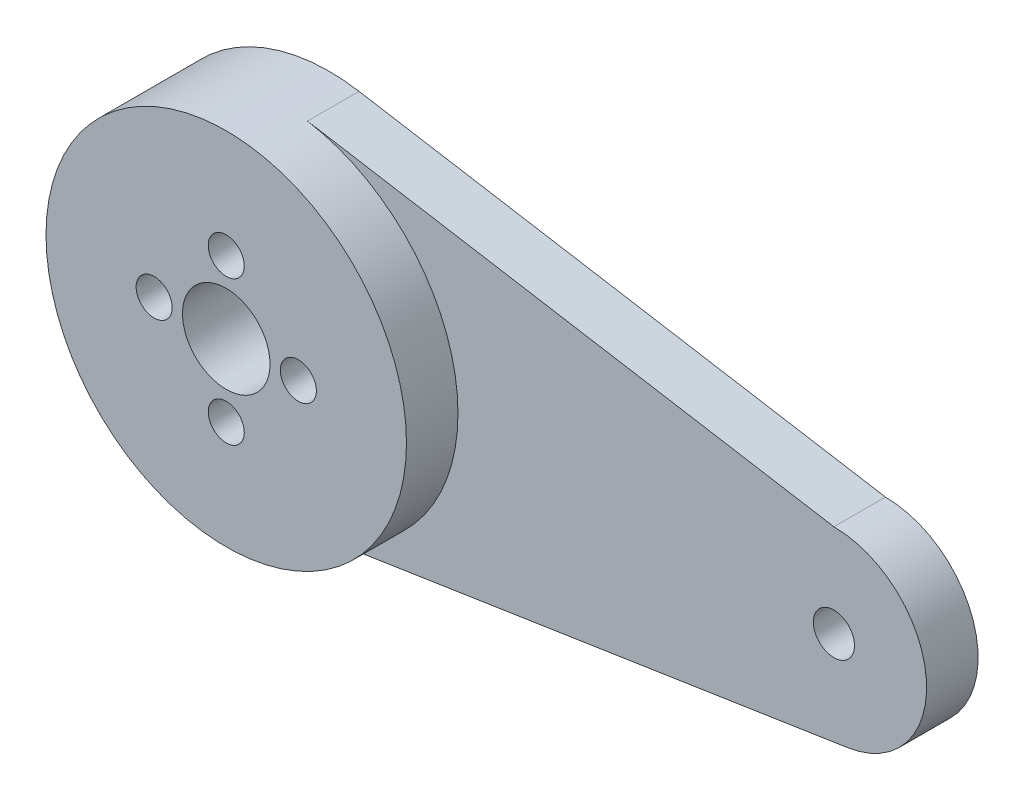
from build123d import *

# Parameters (mm, degrees)
SKETCH2_R           = 4.25
SKETCH2_R_2         = 2
BOSS_EXTRUDE1_DEPTH = 5
SKETCH_1_R          = 1.75
CUT_EXTRUDE_1_DEPTH = 10
EXTRUDE_START       = 5
SKETCH_2_R          = 17.5
SKETCH_2_R_2        = 1.75
SKETCH_2_R_3        = 4.25
EXTRUDE_1_DEPTH     = 5


with BuildPart() as part:
    # Sketch2 → Boss-Extrude1 (new body)
    with BuildSketch(Plane.XY):
        with BuildLine():
            Line((-17.328874887, 74.839530577), (33.78000003, 66.278338859))
            ThreePointArc((33.78000003, 66.278338859), (42.753857637, 57.963816533), (35.14697315, 48.382756557))
            Line((35.14697315, 48.382756557), (-17.561996681, 40.283034413))
            ThreePointArc((-17.561996681, 40.283034413), (-37.719601772, 57.698054173), (-17.328874887, 74.839530577))
        make_face()
        with Locations((-20.21999997, 57.58)):
            Circle(SKETCH2_R, mode=Mode.SUBTRACT)
        with Locations((33.78000003, 57.278338859)):
            Circle(SKETCH2_R_2, mode=Mode.SUBTRACT)
    extrude(amount=-BOSS_EXTRUDE1_DEPTH)

    # 草图1 → 切除-拉伸1 (cut)
    with BuildSketch(Plane.XY):
        with Locations((-13.21999997, 57.58)):
            Circle(SKETCH_1_R)
        with Locations((-27.21999997, 57.58)):
            Circle(SKETCH_1_R)
        with Locations((-20.21999997, 64.58)):
            Circle(SKETCH_1_R)
        with Locations((-20.21999997, 50.58)):
            Circle(SKETCH_1_R)
    extrude(amount=-CUT_EXTRUDE_1_DEPTH, mode=Mode.SUBTRACT)

    # 草图2 → 凸台-拉伸1 (add)
    with BuildSketch(Plane.XY.offset(EXTRUDE_START)):
        with Locations((-20.21999997, 57.58)):
            Circle(SKETCH_2_R)
        with Locations((-27.21999997, 57.58)):
            Circle(SKETCH_2_R_2, mode=Mode.SUBTRACT)
        with Locations((-20.21999997, 50.58)):
            Circle(SKETCH_2_R_2, mode=Mode.SUBTRACT)
        with Locations((-13.21999997, 57.58)):
            Circle(SKETCH_2_R_2, mode=Mode.SUBTRACT)
        with Locations((-20.21999997, 64.58)):
            Circle(SKETCH_2_R_2, mode=Mode.SUBTRACT)
        with Locations((-20.21999997, 57.58)):
            Circle(SKETCH_2_R_3, mode=Mode.SUBTRACT)
    extrude(amount=-EXTRUDE_1_DEPTH)


solid = part.part
